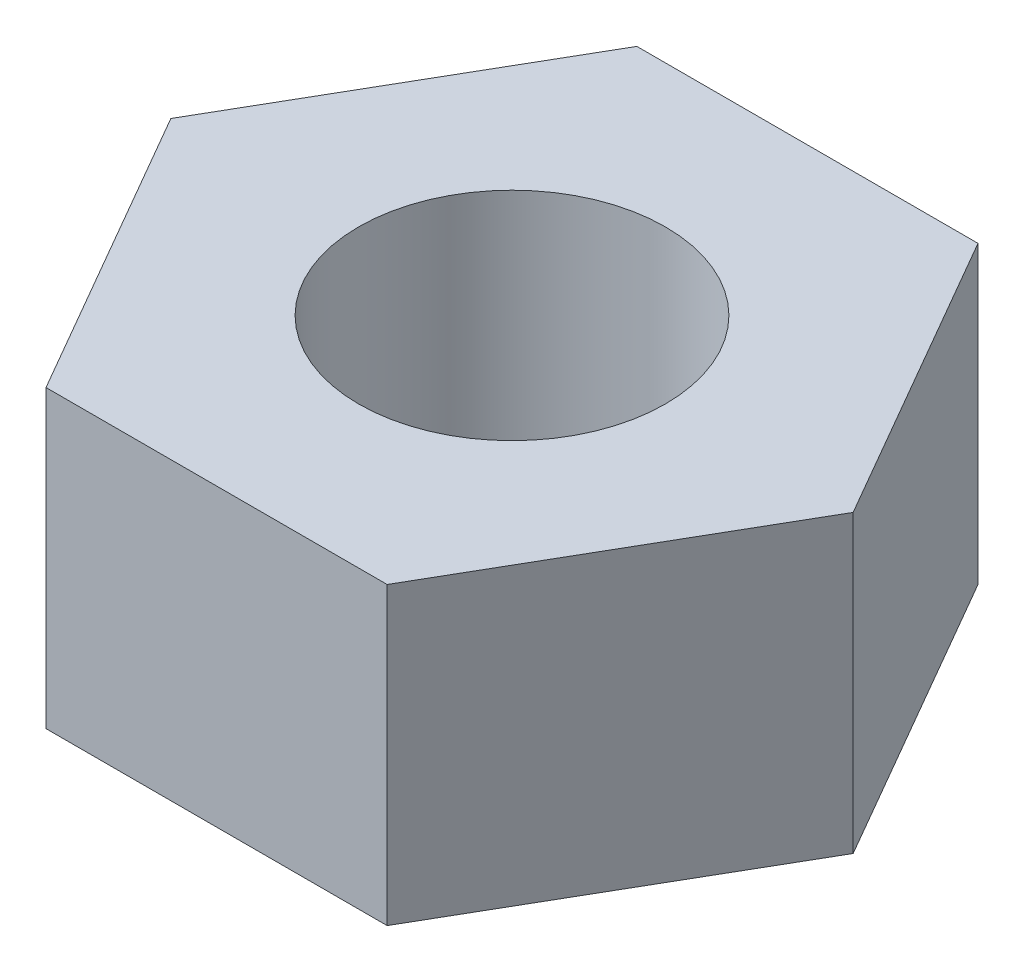
from build123d import *

# Parameters (mm, degrees)
CROQUIS1_R              = 3.375
SALIENTE_EXTRUIR1_DEPTH = 6.5


with BuildPart() as part:
    # Croquis1 → Saliente-Extruir1 (new body)
    with BuildSketch(Plane(origin=(0, 0, 0), x_dir=(1, 0, 0), z_dir=(0, 1, 0))):
        Polygon((-3.75277675, 6.5), (-7.505553499, 0), (-3.75277675, -6.5), (3.75277675, -6.5), (7.505553499, 0), (3.75277675, 6.5), align=None)
        with Locations(Location((0, 0, 0), (0, 0, 90))):
            Circle(CROQUIS1_R, mode=Mode.SUBTRACT)
    extrude(amount=SALIENTE_EXTRUIR1_DEPTH)


solid = part.part
